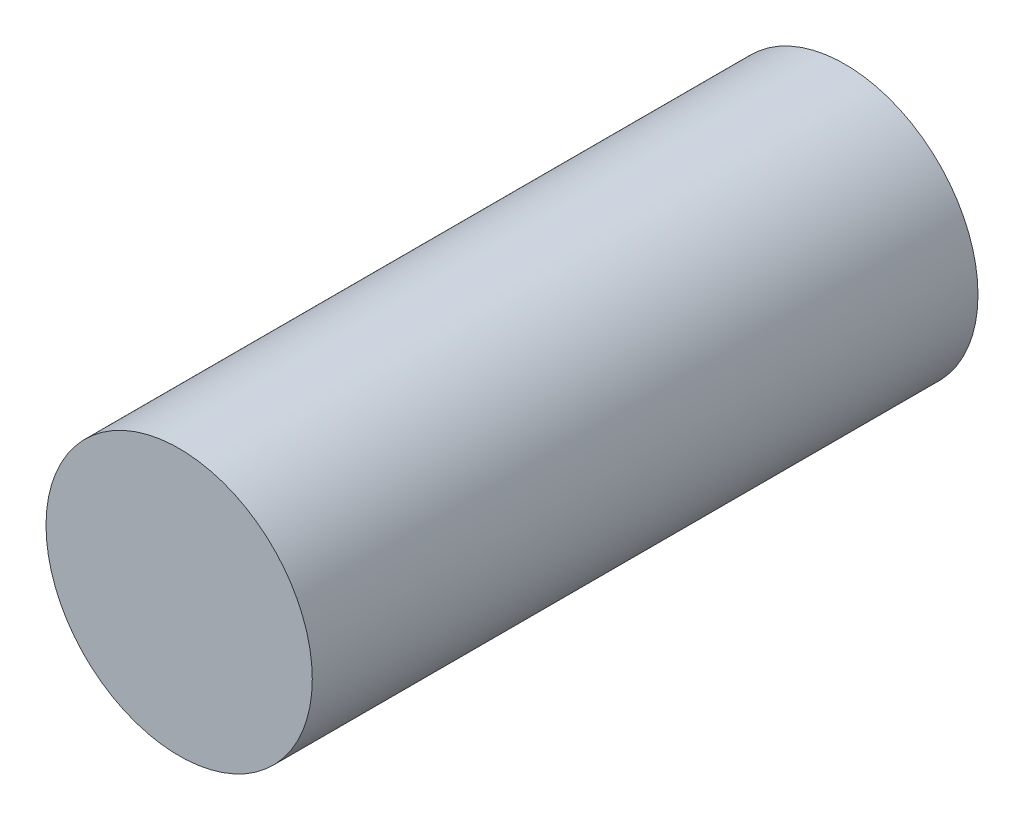
from build123d import *

# Parameters (mm, degrees)
SKETCH_1_R      = 20
EXTRUDE_1_DEPTH = 100


with BuildPart() as part:
    # ｽｹｯﾁ1 → ﾎﾞｽ - 押し出し1 (new body)
    with BuildSketch(Plane.XY):
        Circle(SKETCH_1_R)
    extrude(amount=EXTRUDE_1_DEPTH)


solid = part.part
